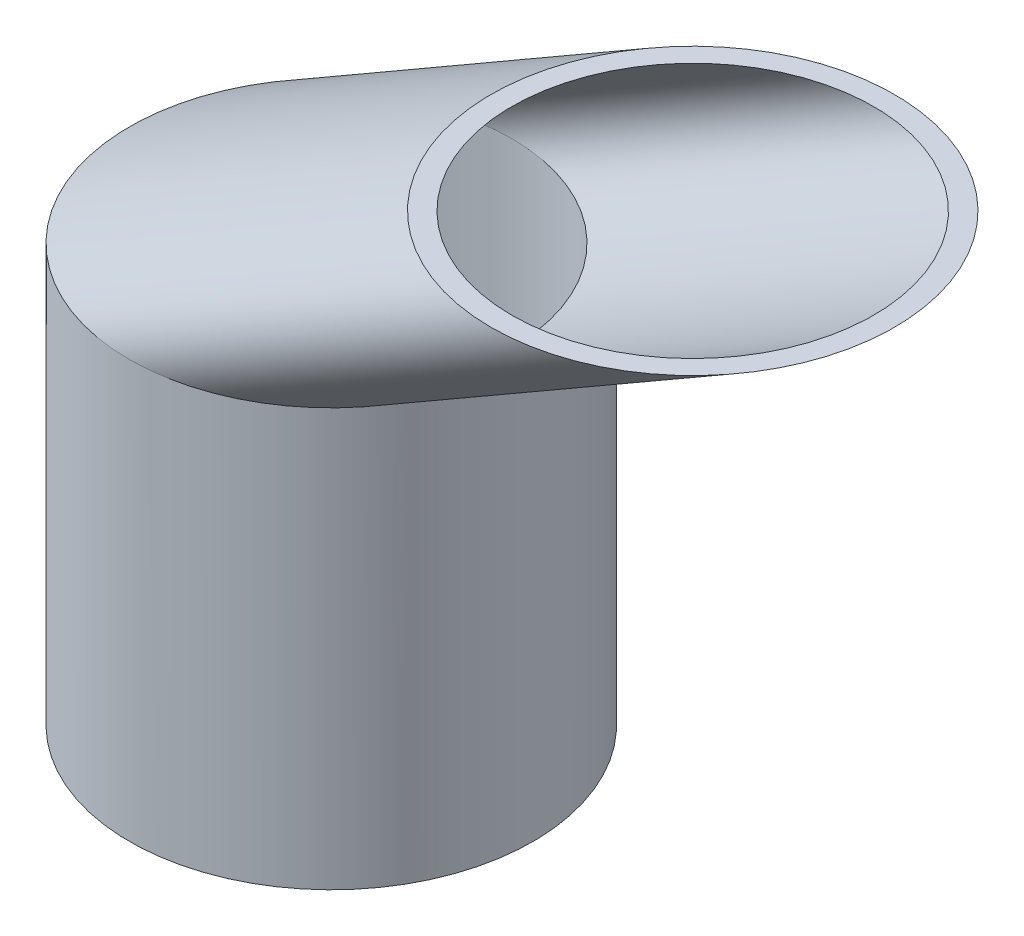
from build123d import *

# Parameters (mm, degrees)
SKETCH2_R           = 18.415
SKETCH2_R_2         = 16.51
BOSS_EXTRUDE1_DEPTH = 38.1
SKETCH7_R           = 18.415
SKETCH7_R_2         = 16.51
BOSS_EXTRUDE5_DEPTH = 38.1


with BuildPart() as part:
    # Sketch2 → Boss-Extrude1 (new body)
    with BuildSketch(Plane(origin=(0, 0, 0), x_dir=(1, 0, 0), z_dir=(0, 1, 0))):
        with Locations(Location((0, 0, 0), (0, 0, 90))):
            Circle(SKETCH2_R)
        with Locations(Location((0, 0, 0), (0, 0, 90))):
            Circle(SKETCH2_R_2, mode=Mode.SUBTRACT)
    extrude(amount=BOSS_EXTRUDE1_DEPTH)

    # Sketch7 → Boss-Extrude5 (add, along a direction that is not the sketch's normal)
    with BuildSketch(Plane(origin=(0, 38.1, 0), x_dir=(1, 0, 0), z_dir=(0, 1, 0))):
        with Locations(Location((0, 0, 0), (0, 0, 90))):
            Circle(SKETCH7_R)
        with Locations(Location((0, 0, 0), (0, 0, 90))):
            Circle(SKETCH7_R_2, mode=Mode.SUBTRACT)
    extrude(amount=BOSS_EXTRUDE5_DEPTH, dir=(0.8660254037844398, 0.499999999999998, 0))


solid = part.part
